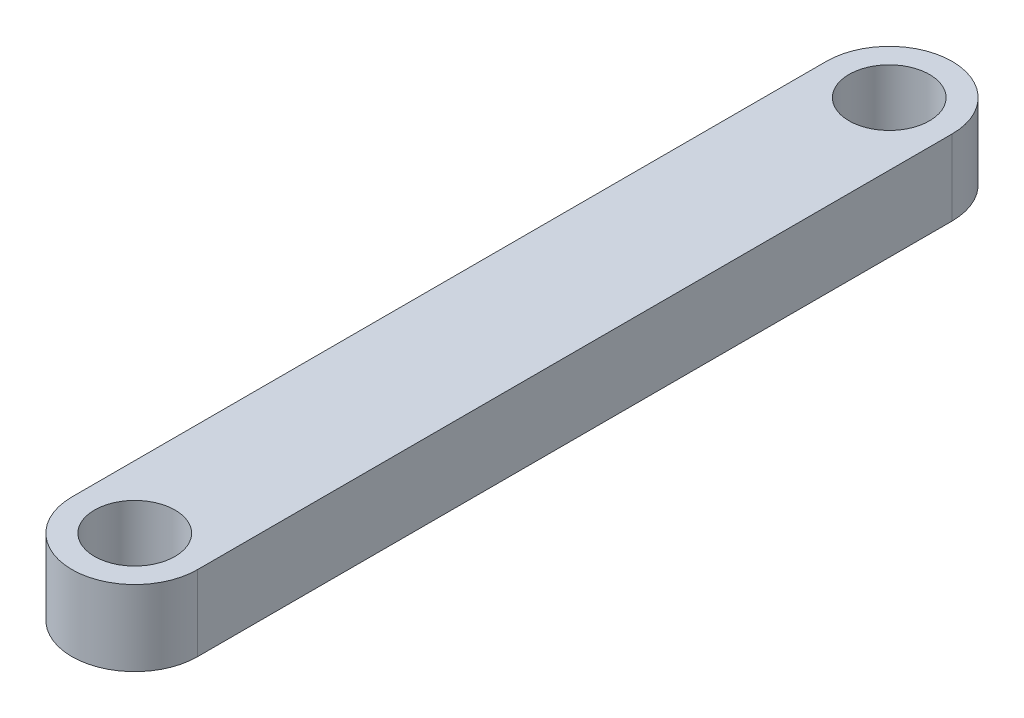
from build123d import *

# Parameters (mm, degrees)
BOSS_EXTRUDE1_DEPTH = 3
SKETCH2_R           = 1.6
CUT_EXTRUDE1_DEPTH  = 33.733774607


with BuildPart() as part:
    # Sketch1 → Boss-Extrude1 (new body)
    with BuildSketch(Plane(origin=(0, 0, 0), x_dir=(1, 0, 0), z_dir=(0, 1, 0))):
        with BuildLine():
            Line((2.5, 0), (2.5, -30))
            ThreePointArc((2.5, -30), (0, -32.5), (-2.5, -30))
            Line((-2.5, -30), (-2.5, 0))
            ThreePointArc((-2.5, 0), (0, 2.5), (2.5, 0))
        make_face()
    extrude(amount=BOSS_EXTRUDE1_DEPTH)

    # Sketch2 → Cut-Extrude1 (cut, through all)
    with BuildSketch(Plane(origin=(0, 3, 0), x_dir=(1, 0, 0), z_dir=(0, 1, 0))):
        with Locations(Location((0, 0, 0), (0, 0, 270))):
            Circle(SKETCH2_R)
        with Locations(Location((0, -30, 0), (0, 0, 270))):
            Circle(SKETCH2_R)
    extrude(amount=-CUT_EXTRUDE1_DEPTH, mode=Mode.SUBTRACT)


solid = part.part
